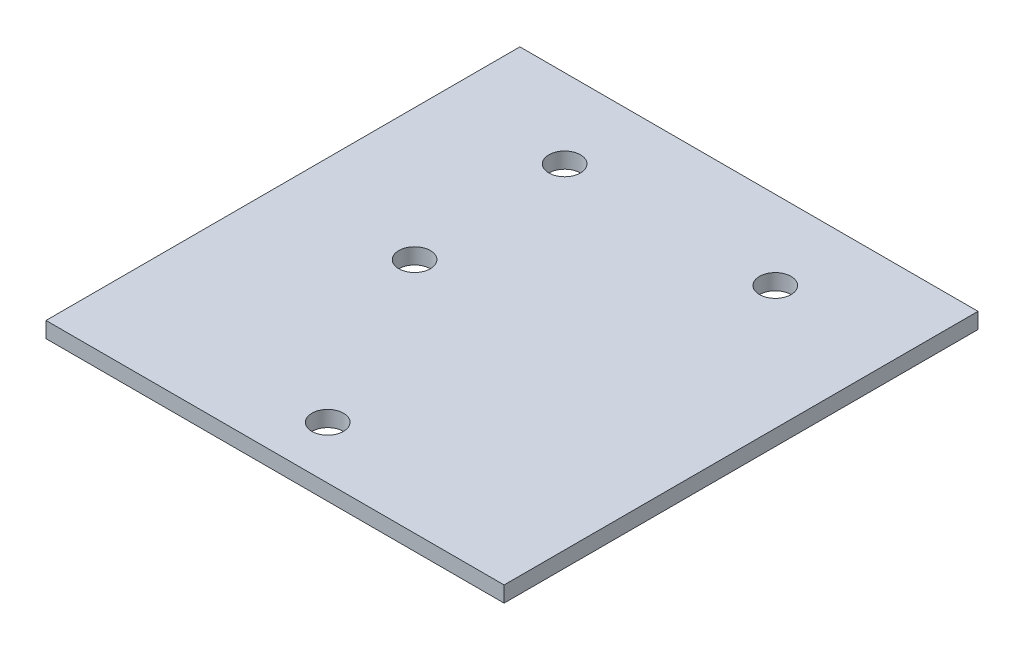
from build123d import *

# Parameters (mm, degrees)
SKETCH1_W           = 87
SKETCH1_H           = 90
BOSS_EXTRUDE1_DEPTH = 3
SKETCH2_R           = 3
CUT_EXTRUDE1_DEPTH  = 63.659795723
SKETCH3_R           = 3
CUT_EXTRUDE2_DEPTH  = 63.659795723


with BuildPart() as part:
    # Sketch1 → Boss-Extrude1 (new body)
    with BuildSketch(Plane(origin=(0, 0, 0), x_dir=(1, 0, 0), z_dir=(0, 1, 0))):
        Rectangle(SKETCH1_W, SKETCH1_H)
    extrude(amount=BOSS_EXTRUDE1_DEPTH)

    # Sketch2 → Cut-Extrude1 (cut, through all)
    with BuildSketch(Plane(origin=(0, 3, 0), x_dir=(1, 0, 0), z_dir=(0, 1, 0))):
        with Locations(Location((-18.5, 0, 0), (0, 0, 270))):
            Circle(SKETCH2_R)
    extrude(amount=-CUT_EXTRUDE1_DEPTH, mode=Mode.SUBTRACT)

    # Sketch3 → Cut-Extrude2 (cut, through all)
    with BuildSketch(Plane.XZ):
        with Locations(Location((0, 35, 0), (0, 0, 270))):
            Circle(SKETCH3_R)
        with Locations(Location((-20, -30, 0), (0, 0, 270))):
            Circle(SKETCH3_R)
        with Locations(Location((20, -30, 0), (0, 0, 270))):
            Circle(SKETCH3_R)
    extrude(amount=-CUT_EXTRUDE2_DEPTH, mode=Mode.SUBTRACT)


solid = part.part
